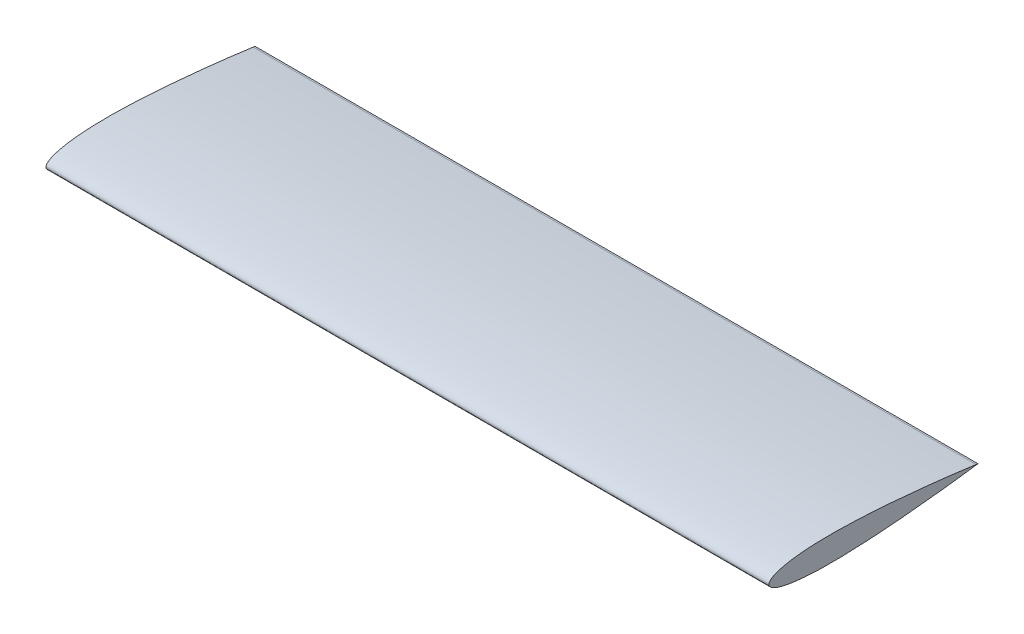
from build123d import *

# Parameters (mm, degrees)
BOSS_EXTRUDE1_DEPTH = 177.714671014
BOSS_EXTRUDE2_DEPTH = 527.05


with BuildPart() as part:
    # Sketch1 → Boss-Extrude1 (new body)
    with BuildSketch(Plane.ZY.offset(-527.05)):
        with BuildLine():
            Line((90.256600966, 127.190314683), (88.9, 127))
            Line((88.9, 127), (90.256600966, 126.809685317))
            add(Edge.make_bspline(
                [(90.256600966, 127.190314683), (90.285998949, 127.194438864), (90.403517599, 127.210925307), (90.667677308, 127.247907233), (91.107254438, 127.309315268), (91.721225997, 127.39468201), (92.508157286, 127.503483942), (93.466208372, 127.635007189), (94.593146869, 127.788436676), (95.886339404, 127.962786274), (97.342764986, 128.157028283), (98.959025026, 128.369940625), (100.731340522, 128.600379614), (102.655583818, 128.846929333), (104.727251041, 129.108325484), (106.941508162, 129.383104882), (109.293177649, 129.669882536), (112.686910903, 130.076092911), (116.24517089, 130.489286188), (119.95964142, 130.90717993), (122.910052341, 131.231514327), (127.037203042, 131.67435662), (132.409964501, 132.228543619), (137.914306642, 132.763837247), (142.458441394, 133.183885291), (145.953084287, 133.494941661), (149.494023036, 133.797264865), (153.073000836, 134.089022571), (156.681653184, 134.368308904), (160.31155448, 134.633255021), (163.954225891, 134.881874949), (167.601164395, 135.11221666), (171.243853054, 135.322321533), (174.873785803, 135.510237645), (178.48249074, 135.674071865), (182.061542786, 135.811964641), (185.602581997, 135.922141929), (189.097337704, 136.002994499), (192.537657068, 136.052985429), (195.915507053, 136.070760167), (199.223000637, 136.055156342), (202.452412847, 136.005240886), (205.596209193, 135.920241091), (208.647052957, 135.799692485), (211.59782117, 135.643369711), (214.441624168, 135.451237843), (217.171837005, 135.223619464), (219.782097978, 134.961041088), (222.266320491, 134.664233336), (224.618731153, 134.334256407), (226.833858393, 133.972224286), (228.906589787, 133.579622743), (230.832133765, 133.15788022), (232.606108506, 132.708729234), (234.224487192, 132.23380033), (235.683708056, 131.734882807), (236.980656583, 131.213648142), (238.112759781, 130.671647799), (239.078010408, 130.110110377), (239.874995811, 129.529673889), (240.502555536, 128.929783753), (240.958659076, 128.308332907), (241.237769713, 127.662624097), (241.330335542, 127), (241.237769713, 126.337375903), (240.958659076, 125.691667093), (240.502555536, 125.070216247), (239.874995811, 124.470326111), (239.078010408, 123.889889623), (238.112759781, 123.328352201), (236.980656583, 122.786351858), (235.683708056, 122.265117193), (234.224487192, 121.76619967), (232.606108506, 121.291270766), (230.832133765, 120.84211978), (228.906589787, 120.420377257), (226.833858393, 120.027775714), (224.618731153, 119.665743593), (222.266320491, 119.335766664), (219.782097978, 119.038958912), (217.171837005, 118.776380536), (214.441624168, 118.548762157), (211.59782117, 118.356630289), (208.647052957, 118.200307515), (205.596209193, 118.079758909), (202.452412847, 117.994759114), (199.223000637, 117.944843658), (195.915507053, 117.929239833), (192.537657068, 117.947014571), (189.097337704, 117.997005501), (185.602581997, 118.077858071), (182.061542786, 118.188035359), (178.48249074, 118.325928135), (174.873785803, 118.489762355), (171.243853054, 118.677678467), (167.601164395, 118.88778334), (163.954225891, 119.118125051), (160.31155448, 119.366744979), (156.681653184, 119.631691096), (153.073000836, 119.910977429), (149.494023036, 120.202735135), (145.953084287, 120.505058339), (142.458441394, 120.816114709), (137.914306642, 121.236162753), (132.409964501, 121.771456381), (127.037203042, 122.32564338), (122.910052341, 122.768485673), (119.95964142, 123.09282007), (116.24517089, 123.510713812), (112.686910903, 123.923907089), (109.293177649, 124.330117464), (106.941508162, 124.616895118), (104.727251041, 124.891674516), (102.655583818, 125.153070667), (100.731340522, 125.399620386), (98.959025026, 125.630059375), (97.342764986, 125.842971717), (95.886339404, 126.037213726), (94.593146869, 126.211563324), (93.466208372, 126.364992811), (92.508157286, 126.496516058), (91.721225997, 126.60531799), (91.107254438, 126.690684732), (90.667677308, 126.752092767), (90.403517599, 126.789074693), (90.285998949, 126.805561136), (90.256600966, 126.809685317)],
                knots=[0, 0, 0, 0, 0.000289146, 0.001155863, 0.002598059, 0.004612289, 0.007193593, 0.010335835, 0.014031413, 0.018271453, 0.023045738, 0.028342882, 0.034150137, 0.040453731, 0.047238593, 0.054488555, 0.062186438, 0.070313976, 0.087780092, 0.097077362, 0.106721847, 0.116690748, 0.137507311, 0.15933101, 0.170556758, 0.181956676, 0.19350401, 0.205171586, 0.216932159, 0.228757987, 0.24062146, 0.252494886, 0.264350491, 0.276160731, 0.287898257, 0.299535925, 0.311046959, 0.322405016, 0.333584241, 0.344559427, 0.355305877, 0.365799652, 0.376017633, 0.385937515, 0.395537821, 0.404798054, 0.413698797, 0.422221689, 0.430349461, 0.438066152, 0.445357166, 0.452209423, 0.458611485, 0.464554009, 0.470029938, 0.475035084, 0.479569179, 0.483636916, 0.487250222, 0.490431493, 0.493218847, 0.49567407, 0.497891229, 0.5, 0.502108771, 0.50432593, 0.506781153, 0.509568507, 0.512749778, 0.516363084, 0.520430821, 0.524964916, 0.529970062, 0.535445991, 0.541388515, 0.547790577, 0.554642834, 0.561933848, 0.569650539, 0.577778311, 0.586301203, 0.595201946, 0.604462179, 0.614062485, 0.623982367, 0.634200348, 0.644694123, 0.655440573, 0.666415759, 0.677594984, 0.688953041, 0.700464075, 0.712101743, 0.723839269, 0.735649509, 0.747505114, 0.75937854, 0.771242013, 0.783067841, 0.794828414, 0.80649599, 0.818043324, 0.829443242, 0.84066899, 0.862492689, 0.883309252, 0.893278153, 0.902922638, 0.912219908, 0.929686024, 0.937813562, 0.945511445, 0.952761407, 0.959546269, 0.965849863, 0.971657118, 0.976954262, 0.981728547, 0.985968587, 0.989664165, 0.992806407, 0.995387711, 0.997401941, 0.998844137, 0.999710854, 1, 1, 1, 1], degree=3))
        make_face()
    extrude(amount=BOSS_EXTRUDE1_DEPTH)

    # Sketch1<2> → Boss-Extrude2 (add)
    with BuildSketch(Plane.ZY.offset(-527.05)):
        with BuildLine():
            Line((90.256600966, 127.190314683), (88.9, 127))
            Line((88.9, 127), (90.256600966, 126.809685317))
            add(Edge.make_bspline(
                [(90.256600966, 127.190314683), (90.285998949, 127.194438864), (90.403517599, 127.210925307), (90.667677308, 127.247907233), (91.107254438, 127.309315268), (91.721225997, 127.39468201), (92.508157286, 127.503483942), (93.466208372, 127.635007189), (94.593146869, 127.788436676), (95.886339404, 127.962786274), (97.342764986, 128.157028283), (98.959025026, 128.369940625), (100.731340522, 128.600379614), (102.655583818, 128.846929333), (104.727251041, 129.108325484), (106.941508162, 129.383104882), (109.293177649, 129.669882536), (112.686910903, 130.076092911), (116.24517089, 130.489286188), (119.95964142, 130.90717993), (122.910052341, 131.231514327), (127.037203042, 131.67435662), (132.409964501, 132.228543619), (137.914306642, 132.763837247), (142.458441394, 133.183885291), (145.953084287, 133.494941661), (149.494023036, 133.797264865), (153.073000836, 134.089022571), (156.681653184, 134.368308904), (160.31155448, 134.633255021), (163.954225891, 134.881874949), (167.601164395, 135.11221666), (171.243853054, 135.322321533), (174.873785803, 135.510237645), (178.48249074, 135.674071865), (182.061542786, 135.811964641), (185.602581997, 135.922141929), (189.097337704, 136.002994499), (192.537657068, 136.052985429), (195.915507053, 136.070760167), (199.223000637, 136.055156342), (202.452412847, 136.005240886), (205.596209193, 135.920241091), (208.647052957, 135.799692485), (211.59782117, 135.643369711), (214.441624168, 135.451237843), (217.171837005, 135.223619464), (219.782097978, 134.961041088), (222.266320491, 134.664233336), (224.618731153, 134.334256407), (226.833858393, 133.972224286), (228.906589787, 133.579622743), (230.832133765, 133.15788022), (232.606108506, 132.708729234), (234.224487192, 132.23380033), (235.683708056, 131.734882807), (236.980656583, 131.213648142), (238.112759781, 130.671647799), (239.078010408, 130.110110377), (239.874995811, 129.529673889), (240.502555536, 128.929783753), (240.958659076, 128.308332907), (241.237769713, 127.662624097), (241.330335542, 127), (241.237769713, 126.337375903), (240.958659076, 125.691667093), (240.502555536, 125.070216247), (239.874995811, 124.470326111), (239.078010408, 123.889889623), (238.112759781, 123.328352201), (236.980656583, 122.786351858), (235.683708056, 122.265117193), (234.224487192, 121.76619967), (232.606108506, 121.291270766), (230.832133765, 120.84211978), (228.906589787, 120.420377257), (226.833858393, 120.027775714), (224.618731153, 119.665743593), (222.266320491, 119.335766664), (219.782097978, 119.038958912), (217.171837005, 118.776380536), (214.441624168, 118.548762157), (211.59782117, 118.356630289), (208.647052957, 118.200307515), (205.596209193, 118.079758909), (202.452412847, 117.994759114), (199.223000637, 117.944843658), (195.915507053, 117.929239833), (192.537657068, 117.947014571), (189.097337704, 117.997005501), (185.602581997, 118.077858071), (182.061542786, 118.188035359), (178.48249074, 118.325928135), (174.873785803, 118.489762355), (171.243853054, 118.677678467), (167.601164395, 118.88778334), (163.954225891, 119.118125051), (160.31155448, 119.366744979), (156.681653184, 119.631691096), (153.073000836, 119.910977429), (149.494023036, 120.202735135), (145.953084287, 120.505058339), (142.458441394, 120.816114709), (137.914306642, 121.236162753), (132.409964501, 121.771456381), (127.037203042, 122.32564338), (122.910052341, 122.768485673), (119.95964142, 123.09282007), (116.24517089, 123.510713812), (112.686910903, 123.923907089), (109.293177649, 124.330117464), (106.941508162, 124.616895118), (104.727251041, 124.891674516), (102.655583818, 125.153070667), (100.731340522, 125.399620386), (98.959025026, 125.630059375), (97.342764986, 125.842971717), (95.886339404, 126.037213726), (94.593146869, 126.211563324), (93.466208372, 126.364992811), (92.508157286, 126.496516058), (91.721225997, 126.60531799), (91.107254438, 126.690684732), (90.667677308, 126.752092767), (90.403517599, 126.789074693), (90.285998949, 126.805561136), (90.256600966, 126.809685317)],
                knots=[0, 0, 0, 0, 0.000289146, 0.001155863, 0.002598059, 0.004612289, 0.007193593, 0.010335835, 0.014031413, 0.018271453, 0.023045738, 0.028342882, 0.034150137, 0.040453731, 0.047238593, 0.054488555, 0.062186438, 0.070313976, 0.087780092, 0.097077362, 0.106721847, 0.116690748, 0.137507311, 0.15933101, 0.170556758, 0.181956676, 0.19350401, 0.205171586, 0.216932159, 0.228757987, 0.24062146, 0.252494886, 0.264350491, 0.276160731, 0.287898257, 0.299535925, 0.311046959, 0.322405016, 0.333584241, 0.344559427, 0.355305877, 0.365799652, 0.376017633, 0.385937515, 0.395537821, 0.404798054, 0.413698797, 0.422221689, 0.430349461, 0.438066152, 0.445357166, 0.452209423, 0.458611485, 0.464554009, 0.470029938, 0.475035084, 0.479569179, 0.483636916, 0.487250222, 0.490431493, 0.493218847, 0.49567407, 0.497891229, 0.5, 0.502108771, 0.50432593, 0.506781153, 0.509568507, 0.512749778, 0.516363084, 0.520430821, 0.524964916, 0.529970062, 0.535445991, 0.541388515, 0.547790577, 0.554642834, 0.561933848, 0.569650539, 0.577778311, 0.586301203, 0.595201946, 0.604462179, 0.614062485, 0.623982367, 0.634200348, 0.644694123, 0.655440573, 0.666415759, 0.677594984, 0.688953041, 0.700464075, 0.712101743, 0.723839269, 0.735649509, 0.747505114, 0.75937854, 0.771242013, 0.783067841, 0.794828414, 0.80649599, 0.818043324, 0.829443242, 0.84066899, 0.862492689, 0.883309252, 0.893278153, 0.902922638, 0.912219908, 0.929686024, 0.937813562, 0.945511445, 0.952761407, 0.959546269, 0.965849863, 0.971657118, 0.976954262, 0.981728547, 0.985968587, 0.989664165, 0.992806407, 0.995387711, 0.997401941, 0.998844137, 0.999710854, 1, 1, 1, 1], degree=3))
        make_face()
    extrude(amount=BOSS_EXTRUDE2_DEPTH)


solid = part.part
